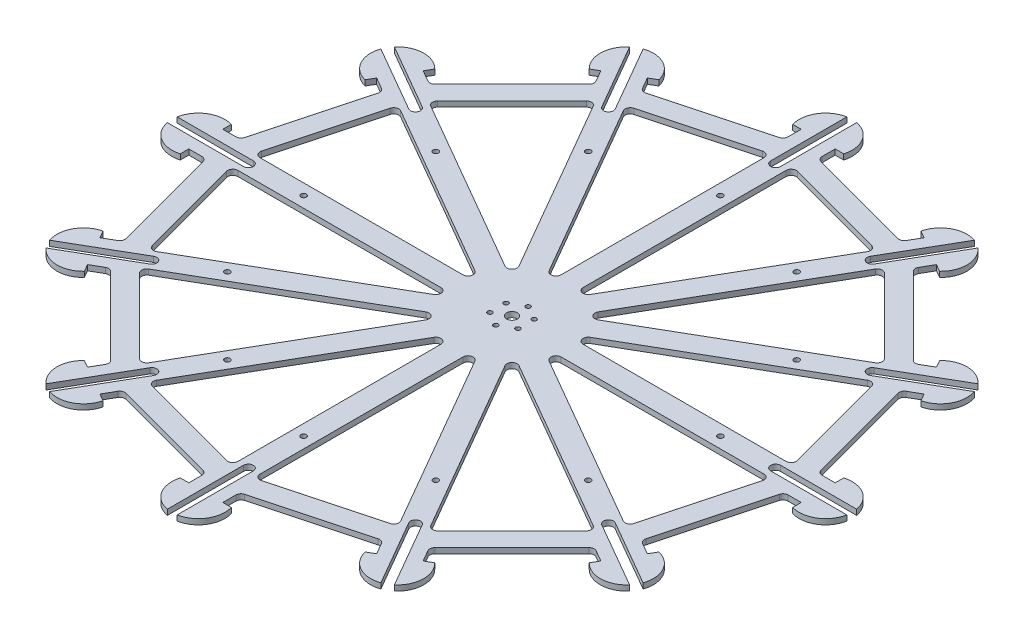
from build123d import *

# Parameters (mm, degrees)
BOSS_EXTRUDE1_DEPTH = 3.18
FILLET1_R           = 3
CIRPATTERN27_COUNT  = 12
SKETCH3_R           = 3.175
CUT_EXTRUDE1_DEPTH  = 283.860588276
SKETCH4_R           = 1.35
CUT_EXTRUDE2_DEPTH  = 283.860588276
SKETCH5_R           = 2
CUT_EXTRUDE3_DEPTH  = 283.860588276
CIRPATTERN28_COUNT  = 12
SKETCH7_R           = 1.6
CUT_EXTRUDE4_DEPTH  = 10
CIRPATTERN29_COUNT  = 12


with BuildPart() as part:
    # Sketch1 → Boss-Extrude1 (new body)
    with BuildSketch(Plane(origin=(0, 0, 0), x_dir=(1, 0, 0), z_dir=(0, 1, 0))):
        with BuildLine():
            Line((0, 0), (0, 200))
            ThreePointArc((0, 200), (12.5, 193.75), (15, 180))
            Line((15, 180), (10, 180))
            Line((10, 180), (10, 170))
            Line((10, 170), (43.169872981, 161.112159322))
            Line((43.169872981, 161.112159322), (40.06404444, 149.521049406))
            Line((40.06404444, 149.521049406), (6.470476128, 158.522418906))
            Line((6.470476128, 158.522418906), (6.470476128, 24.148145657))
            Line((6.470476128, 24.148145657), (0, 0))
        make_face()
    boss_extrude1 = extrude(amount=BOSS_EXTRUDE1_DEPTH)

    # Mirror1: Boss-Extrude1 across plane
    add(boss_extrude1.mirror(Plane(origin=(43.169872981, 3.18, -161.112159322), x_dir=(-0.25881904510252035, 0, 0.9659258262890683), z_dir=(-0.9659258262890684, 0, -0.25881904510252035))))

    # Fillet1
    fillet1_edges = [part.edges().sort_by_distance(p)[0] for p in [
        (6.470476128, 1.59, -24.148145657),
        (73.657612752, 1.59, -140.519679906),
        (6.470476128, 1.59, -158.522418906),
        (76.339745962, 1.59, -152.224318643),
        (10, 1.59, -170),
    ]]
    fillet(fillet1_edges, radius=FILLET1_R)


with BuildPart() as cirpattern27_1:
    # CirPattern27: pattern copy
    add(part.part.rotate(Axis((0, 3.18, 0), (0, -1, 0)), 1 * 360 / CIRPATTERN27_COUNT))


with BuildPart() as cirpattern27_2:
    # CirPattern27: pattern copy
    add(part.part.rotate(Axis((0, 3.18, 0), (0, -1, 0)), 2 * 360 / CIRPATTERN27_COUNT))


with BuildPart() as cirpattern27_3:
    # CirPattern27: pattern copy
    add(part.part.rotate(Axis((0, 3.18, 0), (0, -1, 0)), 3 * 360 / CIRPATTERN27_COUNT))


with BuildPart() as cirpattern27_4:
    # CirPattern27: pattern copy
    add(part.part.rotate(Axis((0, 3.18, 0), (0, -1, 0)), 4 * 360 / CIRPATTERN27_COUNT))


with BuildPart() as cirpattern27_5:
    # CirPattern27: pattern copy
    add(part.part.rotate(Axis((0, 3.18, 0), (0, -1, 0)), 5 * 360 / CIRPATTERN27_COUNT))


with BuildPart() as cirpattern27_6:
    # CirPattern27: pattern copy
    add(part.part.rotate(Axis((0, 3.18, 0), (0, -1, 0)), 6 * 360 / CIRPATTERN27_COUNT))


with BuildPart() as cirpattern27_7:
    # CirPattern27: pattern copy
    add(part.part.rotate(Axis((0, 3.18, 0), (0, -1, 0)), 7 * 360 / CIRPATTERN27_COUNT))


with BuildPart() as cirpattern27_8:
    # CirPattern27: pattern copy
    add(part.part.rotate(Axis((0, 3.18, 0), (0, -1, 0)), 8 * 360 / CIRPATTERN27_COUNT))


with BuildPart() as cirpattern27_9:
    # CirPattern27: pattern copy
    add(part.part.rotate(Axis((0, 3.18, 0), (0, -1, 0)), 9 * 360 / CIRPATTERN27_COUNT))


with BuildPart() as cirpattern27_10:
    # CirPattern27: pattern copy
    add(part.part.rotate(Axis((0, 3.18, 0), (0, -1, 0)), 10 * 360 / CIRPATTERN27_COUNT))


with BuildPart() as cirpattern27_11:
    # CirPattern27: pattern copy
    add(part.part.rotate(Axis((0, 3.18, 0), (0, -1, 0)), 11 * 360 / CIRPATTERN27_COUNT))


with BuildPart() as cirpattern27_8_1:
    add(cirpattern27_8.part)

    # Combine1: union CirPattern27_9, CirPattern27_10, CirPattern27_11, part, CirPattern27_1, CirPattern27_2, CirPattern27_3, CirPattern27_4, CirPattern27_5, CirPattern27_6, CirPattern27_7
    add(cirpattern27_9.part)
    add(cirpattern27_10.part)
    add(cirpattern27_11.part)
    add(part.part)
    add(cirpattern27_1.part)
    add(cirpattern27_2.part)
    add(cirpattern27_3.part)
    add(cirpattern27_4.part)
    add(cirpattern27_5.part)
    add(cirpattern27_6.part)
    add(cirpattern27_7.part)

    # Sketch3 → Cut-Extrude1 (cut, through all)
    with BuildSketch(Plane(origin=(0, 3.18, 0), x_dir=(1, 0, 0), z_dir=(0, 1, 0))):
        Circle(SKETCH3_R)
    extrude(amount=-CUT_EXTRUDE1_DEPTH, mode=Mode.SUBTRACT)

    # Sketch4 → Cut-Extrude2 (cut, through all)
    with BuildSketch(Plane(origin=(0, 3.18, 0), x_dir=(1, 0, 0), z_dir=(0, 1, 0))):
        with Locations((0, 9.5)):
            Circle(SKETCH4_R)
        with Locations((8.227241336, 4.75)):
            Circle(SKETCH4_R)
        with Locations((8.227241336, -4.75)):
            Circle(SKETCH4_R)
        with Locations((0, -9.5)):
            Circle(SKETCH4_R)
        with Locations((-8.227241336, -4.75)):
            Circle(SKETCH4_R)
        with Locations((-8.227241336, 4.75)):
            Circle(SKETCH4_R)
    extrude(amount=-CUT_EXTRUDE2_DEPTH, mode=Mode.SUBTRACT)

    # Sketch5 → Cut-Extrude3 (cut, through all)
    with BuildSketch(Plane(origin=(0, 3.18, 0), x_dir=(1, 0, 0), z_dir=(0, 1, 0))):
        with Locations((0, 185)):
            Circle(SKETCH5_R)
    cut_extrude3 = extrude(amount=-CUT_EXTRUDE3_DEPTH, mode=Mode.SUBTRACT)

    # CirPattern28: Cut-Extrude3 ×12 about axis
    cirpattern28_axis = Axis((0, 3.18, 0), (0, -1, 0))
    for i in range(1, CIRPATTERN28_COUNT):
        add(cut_extrude3.rotate(cirpattern28_axis, i * 360 / CIRPATTERN28_COUNT), mode=Mode.SUBTRACT)

    # Sketch7 → Cut-Extrude4 (cut)
    with BuildSketch(Plane(origin=(0, 3.18, 0), x_dir=(1, 0, 0), z_dir=(0, 1, 0))):
        with Locations((-122.5, 0)):
            Circle(SKETCH7_R)
        with BuildLine():
            Line((155, 2.9), (205, 2.9))
            ThreePointArc((205, 2.9), (207.9, 0), (205, -2.9))
            Line((205, -2.9), (155, -2.9))
            ThreePointArc((155, -2.9), (152.1, 0), (155, 2.9))
        make_face()
    cut_extrude4 = extrude(amount=-CUT_EXTRUDE4_DEPTH, mode=Mode.SUBTRACT)

    # CirPattern29: Cut-Extrude4 ×12 about axis
    cirpattern29_axis = Axis((0, 0, 0), (0, 1, 0))
    for i in range(1, CIRPATTERN29_COUNT):
        add(cut_extrude4.rotate(cirpattern29_axis, i * 360 / CIRPATTERN29_COUNT), mode=Mode.SUBTRACT)


solid = cirpattern27_8_1.part
